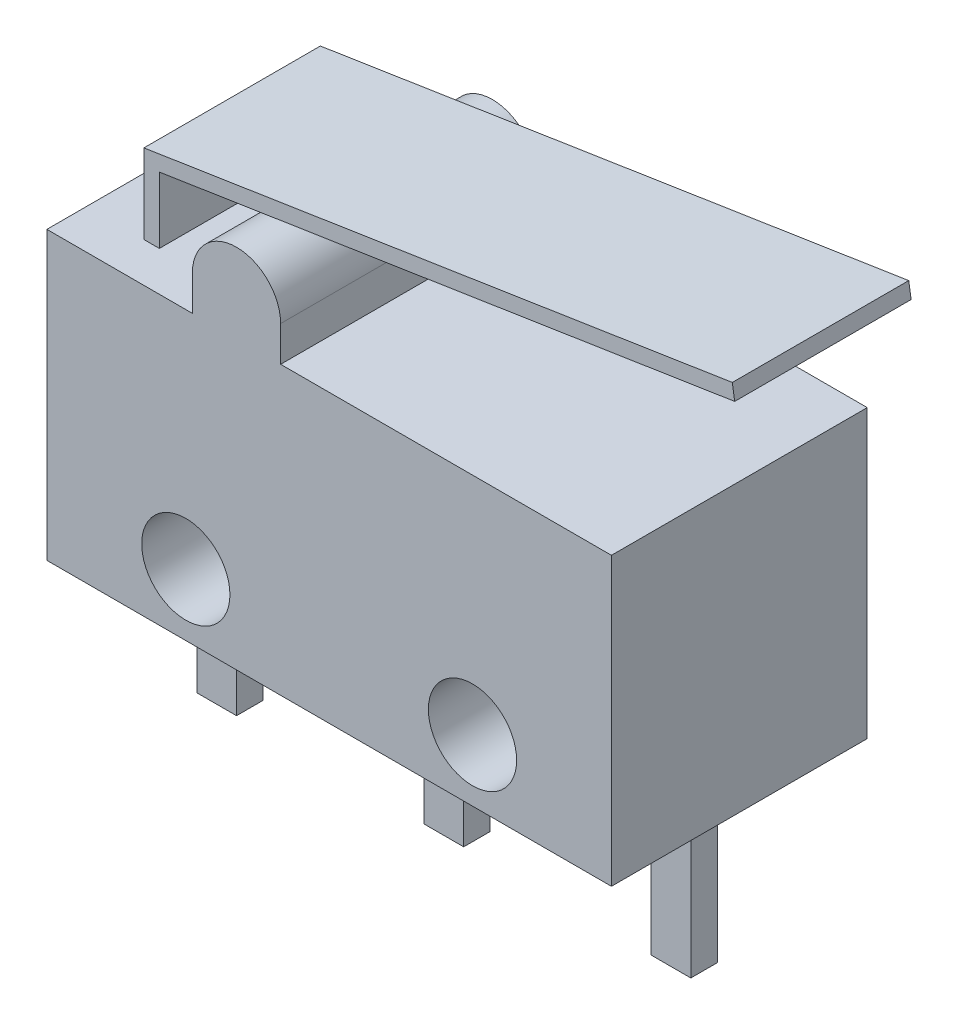
from build123d import *

# Parameters (mm, degrees)
SKETCH1_W           = 12.8
SKETCH1_H           = 5.8
BOSS_EXTRUDE1_DEPTH = 6.5
SKETCH2_R           = 1
CUT_EXTRUDE1_DEPTH  = 16.5
SKETCH3_W           = 0.9
SKETCH3_H           = 0.6
BOSS_EXTRUDE2_DEPTH = 3.5
BOSS_EXTRUDE3_DEPTH = 5.8
BOSS_EXTRUDE4_DEPTH = 2


with BuildPart() as part:
    # Sketch1 → Boss-Extrude1 (new body)
    with BuildSketch(Plane(origin=(0, 0, 0), x_dir=(1, 0, 0), z_dir=(0, 1, 0))):
        Rectangle(SKETCH1_W, SKETCH1_H)
    extrude(amount=BOSS_EXTRUDE1_DEPTH)

    # Sketch2 → Cut-Extrude1 (cut)
    with BuildSketch(Plane.XY.offset(2.9)):
        with Locations((-3.25, 1.4)):
            Circle(SKETCH2_R)
        with Locations((3.25, 1.4)):
            Circle(SKETCH2_R)
    extrude(amount=-CUT_EXTRUDE1_DEPTH, mode=Mode.SUBTRACT)

    # Sketch3 → Boss-Extrude2 (add)
    with BuildSketch(Plane.XZ):
        with Locations((-5.15, 0)):
            Rectangle(SKETCH3_W, SKETCH3_H)
        Rectangle(SKETCH3_W, SKETCH3_H)
        with Locations((5.15, 0)):
            Rectangle(SKETCH3_W, SKETCH3_H)
    extrude(amount=BOSS_EXTRUDE2_DEPTH)

    # Sketch4 → Boss-Extrude3 (add)
    with BuildSketch(Plane.XY.offset(2.9)):
        with BuildLine():
            Line((-3.1, 6.5), (-3.1, 7.3))
            ThreePointArc((-3.1, 7.3), (-2.1, 8.3), (-1.1, 7.3))
            Line((-1.1, 7.3), (-1.1, 6.5))
            Line((-1.1, 6.5), (-3.1, 6.5))
        make_face()
    extrude(amount=-BOSS_EXTRUDE3_DEPTH)

    # Sketch5 → Boss-Extrude4 (add, symmetric)
    with BuildSketch(Plane.XY):
        Polygon((-5.1, 6.5), (-5.1, 8.3), (8.241176471, 10.364705882), (8.294705882, 10.018823529), (-4.75, 8), (-4.75, 6.5), align=None)
    extrude(amount=BOSS_EXTRUDE4_DEPTH, both=True)


solid = part.part
